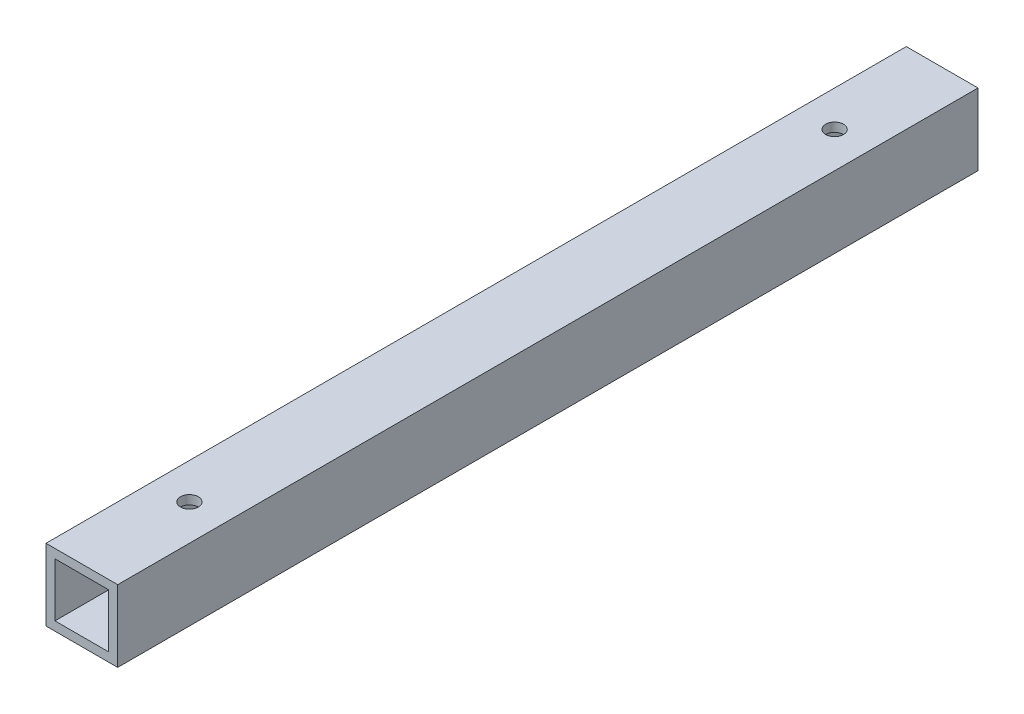
from build123d import *

# Parameters (mm, degrees)
BOSS_EXTRUDE1_DEPTH      = 152.4
BOSS_EXTRUDE1_DEPTH_BACK = 152.4
SKETCH3_W                = 25.4
SKETCH3_H                = 25.4
SKETCH3_W_2              = 19.05
SKETCH3_H_2              = 19.05
SKETCH6_R                = 3.175
CUT_EXTRUDE1_DEPTH       = 156.02325632


with BuildPart() as part:
    # Sketch3 → Boss-Extrude1 (new, two sides: drawn at the far end of the back side and taken through both)
    with BuildSketch(Plane.XY.offset(-BOSS_EXTRUDE1_DEPTH_BACK)):
        Rectangle(SKETCH3_W, SKETCH3_H)
        Rectangle(SKETCH3_W_2, SKETCH3_H_2, mode=Mode.SUBTRACT)
    extrude(amount=BOSS_EXTRUDE1_DEPTH + BOSS_EXTRUDE1_DEPTH_BACK)

    # Sketch6 → Cut-Extrude1 (cut, through all)
    with BuildSketch(Plane(origin=(0, 12.7, 0), x_dir=(0, 0, -1), z_dir=(0, -1, 0))):
        with Locations((-114.3, 0)):
            Circle(SKETCH6_R)
        with Locations(Location((114.3, 0, 0), (0, 0, 180))):
            Circle(SKETCH6_R)
    extrude(amount=CUT_EXTRUDE1_DEPTH, mode=Mode.SUBTRACT)


solid = part.part
